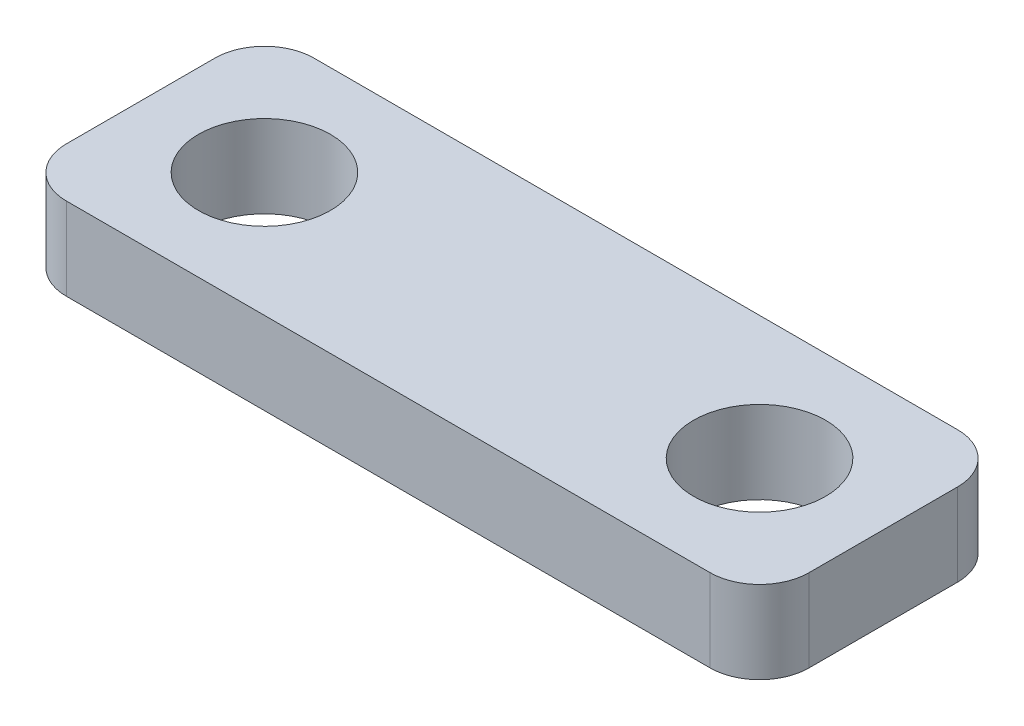
from build123d import *

# Parameters (mm, degrees)
CROQUIS2_W              = 45
CROQUIS2_H              = 15
SALIENTE_EXTRUIR1_DEPTH = 5
REDONDEO1_R             = 3
CROQUIS3_R              = 4
CORTAR_EXTRUIR1_DEPTH   = 10


with BuildPart() as part:
    # Croquis2 → Saliente-Extruir1 (new body)
    with BuildSketch(Plane(origin=(0, 0, 0), x_dir=(1, 0, 0), z_dir=(0, 1, 0))):
        Rectangle(CROQUIS2_W, CROQUIS2_H)
    extrude(amount=SALIENTE_EXTRUIR1_DEPTH)

    # Redondeo1
    redondeo1_edges = [part.edges().sort_by_distance(p)[0] for p in [
        (22.5, 2.5, 7.5),
        (-22.5, 2.5, 7.5),
        (-22.5, 2.5, -7.5),
        (22.5, 2.5, -7.5),
    ]]
    fillet(redondeo1_edges, radius=REDONDEO1_R)

    # Croquis3 → Cortar-Extruir1 (cut, symmetric)
    with BuildSketch(Plane(origin=(0, 5, 0), x_dir=(1, 0, 0), z_dir=(0, 1, 0))):
        with Locations(Location((-15, 0, 0), (0, 0, 90))):
            Circle(CROQUIS3_R)
        with Locations(Location((15, 0, 0), (0, 0, 90))):
            Circle(CROQUIS3_R)
    extrude(amount=CORTAR_EXTRUIR1_DEPTH, both=True, mode=Mode.SUBTRACT)


solid = part.part
